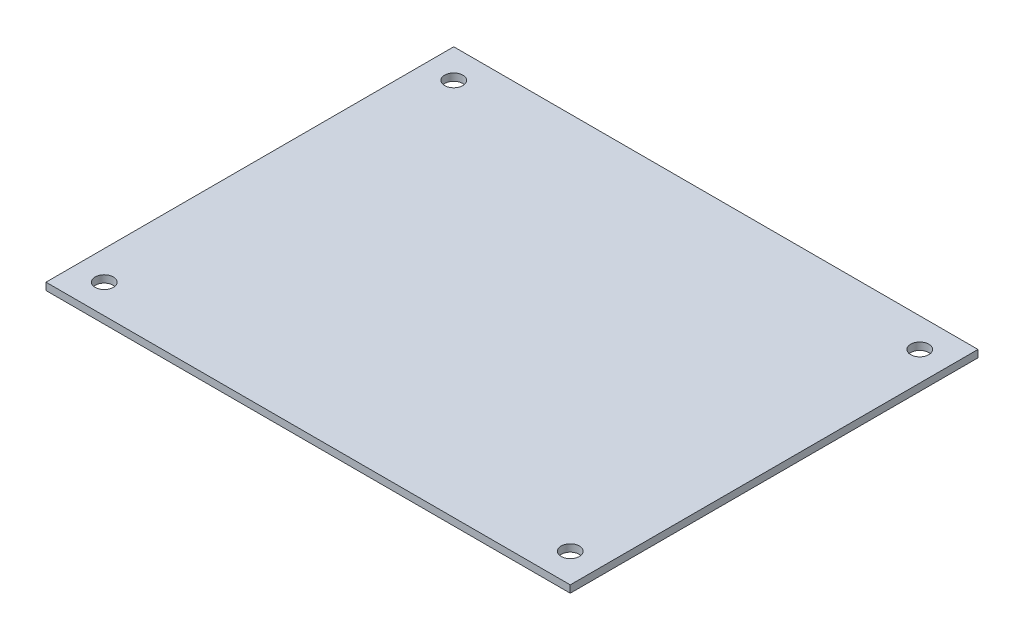
from build123d import *

# Parameters (mm, degrees)
SKETCH1_W           = 91.44
SKETCH1_H           = 71.12
SKETCH1_R           = 1.5875
BOSS_EXTRUDE1_DEPTH = 1.27


with BuildPart() as part:
    # Sketch1 → Boss-Extrude1 (new body)
    with BuildSketch(Plane(origin=(0, 0, 0), x_dir=(1, 0, 0), z_dir=(0, 1, 0))):
        Rectangle(SKETCH1_W, SKETCH1_H)
        with Locations((-40.64, 30.48)):
            Circle(SKETCH1_R, mode=Mode.SUBTRACT)
        with Locations((40.64, 30.48)):
            Circle(SKETCH1_R, mode=Mode.SUBTRACT)
        with Locations((40.64, -30.48)):
            Circle(SKETCH1_R, mode=Mode.SUBTRACT)
        with Locations((-40.64, -30.48)):
            Circle(SKETCH1_R, mode=Mode.SUBTRACT)
    extrude(amount=BOSS_EXTRUDE1_DEPTH)


solid = part.part
